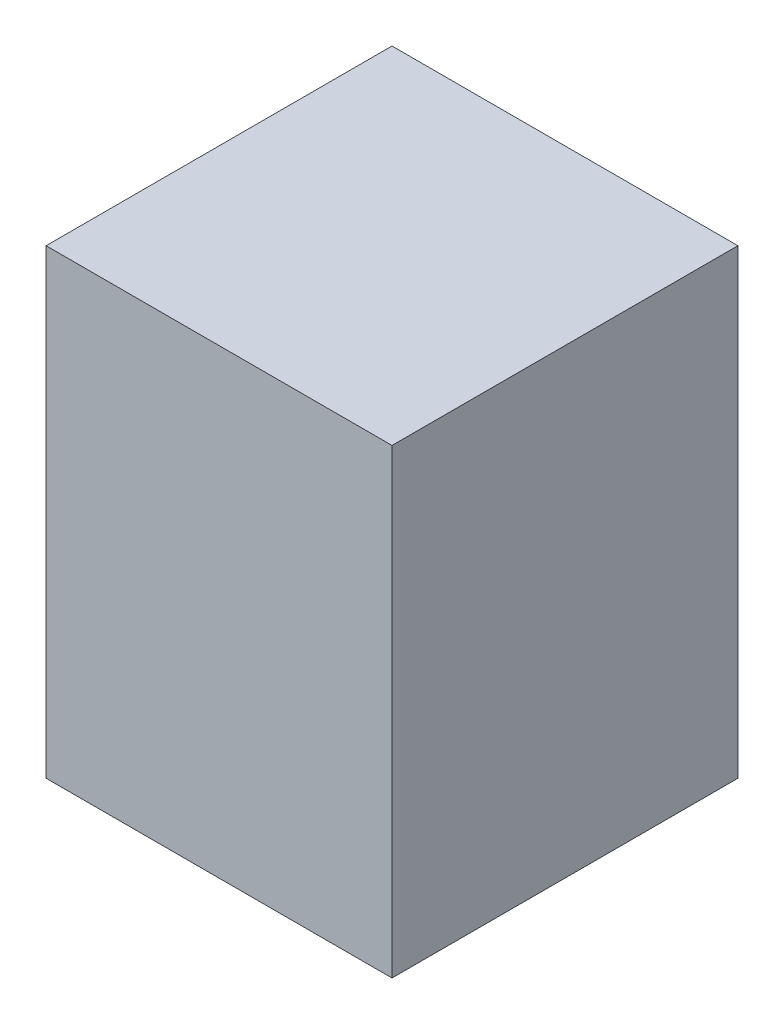
from build123d import *

# Parameters (mm, degrees)
SKETCH_1_W      = 6
SKETCH_1_H      = 6
EXTRUDE_1_DEPTH = 8


with BuildPart() as part:
    # Эскиз1 → Бобышка-Вытянуть1 (new body)
    with BuildSketch(Plane(origin=(0, 0, 0), x_dir=(1, 0, 0), z_dir=(0, 1, 0))):
        with Locations((3, -3)):
            Rectangle(SKETCH_1_W, SKETCH_1_H)
    extrude(amount=EXTRUDE_1_DEPTH)


solid = part.part
